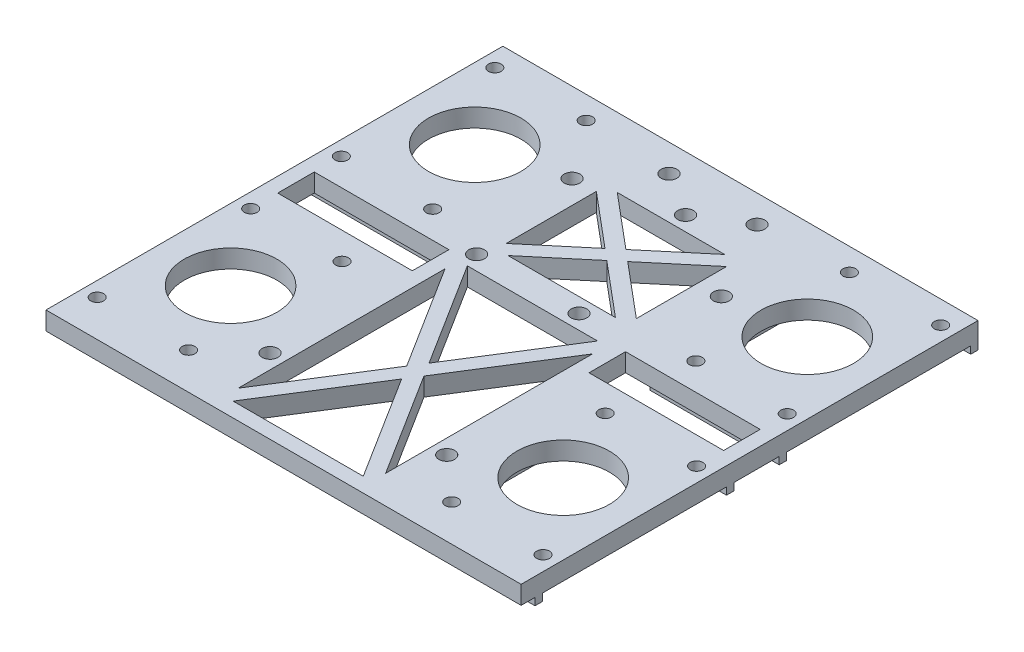
from build123d import *

# Parameters (mm, degrees)
SKETCH1_W                 = 130
SKETCH1_H                 = 125
BOSS_EXTRUDE1_DEPTH       = 5
SKETCH2_R                 = 1.75
SKETCH2_R_2               = 12.65
CUT_EXTRUDE1_DEPTH        = 10
SKETCH4_R                 = 2.15
CUT_EXTRUDE3_DEPTH        = 10
BOSS_EXTRUDE2_DEPTH       = 2
MIRROR7_COPY_1_SKETCH_R   = 1.75
MIRROR7_COPY_1_SKETCH_R_2 = 12.65
MIRROR7_COPY_1_DEPTH      = 10
MIRROR7_COPY_2_SKETCH_R   = 1.75
MIRROR7_COPY_2_SKETCH_R_2 = 12.65
MIRROR7_COPY_2_DEPTH      = 10
MIRROR7_COPY_3_DEPTH      = 2
SKETCH10_R                = 2.15
CUT_EXTRUDE8_DEPTH        = 91.311959341
SKETCH11_R                = 2.65
CUT_EXTRUDE9_DEPTH        = 0.5
CUT_EXTRUDE10_DEPTH       = 91.444734507
CUT_EXTRUDE11_DEPTH       = 91.444734507
CUT_EXTRUDE12_DEPTH       = 91.444734507


with BuildPart() as part:
    # Sketch1 → Boss-Extrude1 (new body)
    with BuildSketch(Plane(origin=(0, 0, 0), x_dir=(1, 0, 0), z_dir=(0, 1, 0))):
        Rectangle(SKETCH1_W, SKETCH1_H)
    extrude(amount=BOSS_EXTRUDE1_DEPTH)

    # Sketch2 → Cut-Extrude1 (cut)
    with BuildSketch(Plane(origin=(0, 5, 0), x_dir=(1, 0, 0), z_dir=(0, 1, 0))):
        with Locations((-61, -52.5)):
            Circle(SKETCH2_R)
        with Locations((-36, -52.5)):
            Circle(SKETCH2_R)
        with Locations((-36, -10.5)):
            Circle(SKETCH2_R)
        with Locations((-61, -10.5)):
            Circle(SKETCH2_R)
        with Locations((-45.5, -31.5)):
            Circle(SKETCH2_R_2)
    cut_extrude1 = extrude(amount=-CUT_EXTRUDE1_DEPTH, mode=Mode.SUBTRACT)

    # Mirror3: Cut-Extrude1 across plane
    add(cut_extrude1.mirror(Plane.ZY), mode=Mode.SUBTRACT)

    # Sketch4 → Cut-Extrude3 (cut)
    with BuildSketch(Plane(origin=(0, 5, 0), x_dir=(1, 0, 0), z_dir=(0, 1, 0))):
        with Locations((0, 47.5)):
            Circle(SKETCH4_R)
        with Locations((12.049810205, 55)):
            Circle(SKETCH4_R)
        with Locations((-12.049810205, 55)):
            Circle(SKETCH4_R)
    extrude(amount=-CUT_EXTRUDE3_DEPTH, mode=Mode.SUBTRACT)

    # Sketch5 → Boss-Extrude2 (add)
    with BuildSketch(Plane.XZ):
        Polygon((-65, 58.7), (-65, 56.7), (-31.6, 56.7), (-31.6, 6.3), (-65, 6.3), (-65, 4.3), (-29.6, 4.3), (-29.6, 58.7), align=None)
    boss_extrude2 = extrude(amount=BOSS_EXTRUDE2_DEPTH)

    # Mirror5: Boss-Extrude2 across plane
    add(boss_extrude2.mirror(Plane.ZY))

    # Mirror7: Boss-Extrude2 across plane
    add(boss_extrude2.mirror(Plane.XY.offset(-1.9)))

    # Mirror7 copy 1 sketch → Mirror7 copy 1 (cut)
    with BuildSketch(Plane(origin=(0, 5, -3.8), x_dir=(-1, 0, 0), z_dir=(0, 1, 0))):
        with Locations((-61, -52.5)):
            Circle(MIRROR7_COPY_1_SKETCH_R)
        with Locations((-36, -52.5)):
            Circle(MIRROR7_COPY_1_SKETCH_R)
        with Locations((-36, -10.5)):
            Circle(MIRROR7_COPY_1_SKETCH_R)
        with Locations((-61, -10.5)):
            Circle(MIRROR7_COPY_1_SKETCH_R)
        with Locations((-45.5, -31.5)):
            Circle(MIRROR7_COPY_1_SKETCH_R_2)
    extrude(amount=-MIRROR7_COPY_1_DEPTH, mode=Mode.SUBTRACT)

    # Mirror7 copy 2 sketch → Mirror7 copy 2 (cut)
    with BuildSketch(Plane(origin=(0, 5, -3.8), x_dir=(1, 0, 0), z_dir=(0, 1, 0))):
        with Locations((-61, 52.5)):
            Circle(MIRROR7_COPY_2_SKETCH_R)
        with Locations((-36, 52.5)):
            Circle(MIRROR7_COPY_2_SKETCH_R)
        with Locations((-36, 10.5)):
            Circle(MIRROR7_COPY_2_SKETCH_R)
        with Locations((-61, 10.5)):
            Circle(MIRROR7_COPY_2_SKETCH_R)
        with Locations((-45.5, 31.5)):
            Circle(MIRROR7_COPY_2_SKETCH_R_2)
    extrude(amount=-MIRROR7_COPY_2_DEPTH, mode=Mode.SUBTRACT)

    # Mirror7 copy 3 sketch → Mirror7 copy 3 (add)
    with BuildSketch(Plane(origin=(0, 0, -3.8), x_dir=(-1, 0, 0), z_dir=(0, -1, 0))):
        Polygon((-65, 58.7), (-65, 56.7), (-31.6, 56.7), (-31.6, 6.3), (-65, 6.3), (-65, 4.3), (-29.6, 4.3), (-29.6, 58.7), align=None)
    extrude(amount=MIRROR7_COPY_3_DEPTH)

    # Sketch10 → Cut-Extrude8 (cut, through all)
    with BuildSketch(Plane(origin=(0, 0, 0), x_dir=(-1, 0, 0), z_dir=(0, -1, 0))):
        with Locations((-24.17, -42.03)):
            Circle(SKETCH10_R)
        with Locations((24.17, -42.03)):
            Circle(SKETCH10_R)
        with Locations((-8.73, 9.6)):
            Circle(SKETCH10_R)
        with Locations((19.29, 9.6)):
            Circle(SKETCH10_R)
        with Locations((-24.17, 33.11)):
            Circle(SKETCH10_R)
        with Locations((24.17, 40.6)):
            Circle(SKETCH10_R)
    extrude(amount=-CUT_EXTRUDE8_DEPTH, mode=Mode.SUBTRACT)

    # Sketch11 → Cut-Extrude9 (cut)
    with BuildSketch(Plane.XZ):
        with Locations((-12.049810205, -55)):
            Circle(SKETCH11_R)
        with Locations((0, -47.5)):
            Circle(SKETCH11_R)
        with Locations((12.049810205, -55)):
            Circle(SKETCH11_R)
        with Locations((-24.17, -40.6)):
            Circle(SKETCH11_R)
        with Locations((24.17, -33.11)):
            Circle(SKETCH11_R)
        with Locations((8.73, -9.6)):
            Circle(SKETCH11_R)
        with Locations((-19.29, -9.6)):
            Circle(SKETCH11_R)
        with Locations((-24.17, 42.03)):
            Circle(SKETCH11_R)
        with Locations((24.17, 42.03)):
            Circle(SKETCH11_R)
        with Locations((-61, -14.3)):
            Circle(SKETCH11_R)
        with Locations((-36, -14.3)):
            Circle(SKETCH11_R)
        with Locations((-61, -56.3)):
            Circle(SKETCH11_R)
        with Locations((-36, -56.3)):
            Circle(SKETCH11_R)
        with Locations((36, -56.3)):
            Circle(SKETCH11_R)
        with Locations((61, -56.3)):
            Circle(SKETCH11_R)
        with Locations((36, -14.3)):
            Circle(SKETCH11_R)
        with Locations((61, -14.3)):
            Circle(SKETCH11_R)
        with Locations((36, 10.5)):
            Circle(SKETCH11_R)
        with Locations((61, 10.5)):
            Circle(SKETCH11_R)
        with Locations((61, 52.5)):
            Circle(SKETCH11_R)
        with Locations((36, 52.5)):
            Circle(SKETCH11_R)
        with Locations((-36, 52.5)):
            Circle(SKETCH11_R)
        with Locations((-36, 10.5)):
            Circle(SKETCH11_R)
        with Locations((-61, 10.5)):
            Circle(SKETCH11_R)
        with Locations((-61, 52.5)):
            Circle(SKETCH11_R)
    extrude(amount=-CUT_EXTRUDE9_DEPTH, mode=Mode.SUBTRACT)

    # Sketch12 → Cut-Extrude10 (cut, through all)
    with BuildSketch(Plane(origin=(0, 5, 0), x_dir=(1, 0, 0), z_dir=(0, 1, 0))):
        Polygon((17.806904396, 5.6), (-17.806904396, 5.6), (0, -22.695056316), align=None)
        Polygon((-2.363095604, -26.45), (-20.17, 1.845056316), (-20.17, -54.745056316), align=None)
        Polygon((20.17, -54.745056316), (20.17, 1.845056316), (2.363095604, -26.45), align=None)
        Polygon((0, -30.204943684), (-17.806904396, -58.5), (17.806904396, -58.5), align=None)
    extrude(amount=-CUT_EXTRUDE10_DEPTH, mode=Mode.SUBTRACT)

    # Sketch13 → Cut-Extrude11 (cut, through all)
    with BuildSketch(Plane(origin=(0, 5, 0), x_dir=(1, 0, 0), z_dir=(0, 1, 0))):
        Polygon((-61, 1.9), (-61, -3.1), (-24.17, -3.1), (-24.17, 6.9), (-61, 6.9), align=None)
    cut_extrude11 = extrude(amount=-CUT_EXTRUDE11_DEPTH, mode=Mode.SUBTRACT)

    # Mirror9: Cut-Extrude11 across plane
    add(cut_extrude11.mirror(Plane.ZY), mode=Mode.SUBTRACT)

    # Sketch14 → Cut-Extrude12 (cut, through all)
    with BuildSketch(Plane(origin=(0, 5, 0), x_dir=(1, 0, 0), z_dir=(0, 1, 0))):
        Polygon((14.696462151, 43.5), (-14.696462151, 43.5), (0, 31.161409065), align=None)
        Polygon((-3.110442245, 28.55), (-17.806904396, 40.888590935), (-17.806904396, 16.211409065), align=None)
        Polygon((17.806904396, 16.211409065), (17.806904396, 40.888590935), (3.110442245, 28.55), align=None)
        Polygon((0, 25.938590935), (-14.696462151, 13.6), (14.696462151, 13.6), align=None)
    extrude(amount=-CUT_EXTRUDE12_DEPTH, mode=Mode.SUBTRACT)


solid = part.part
